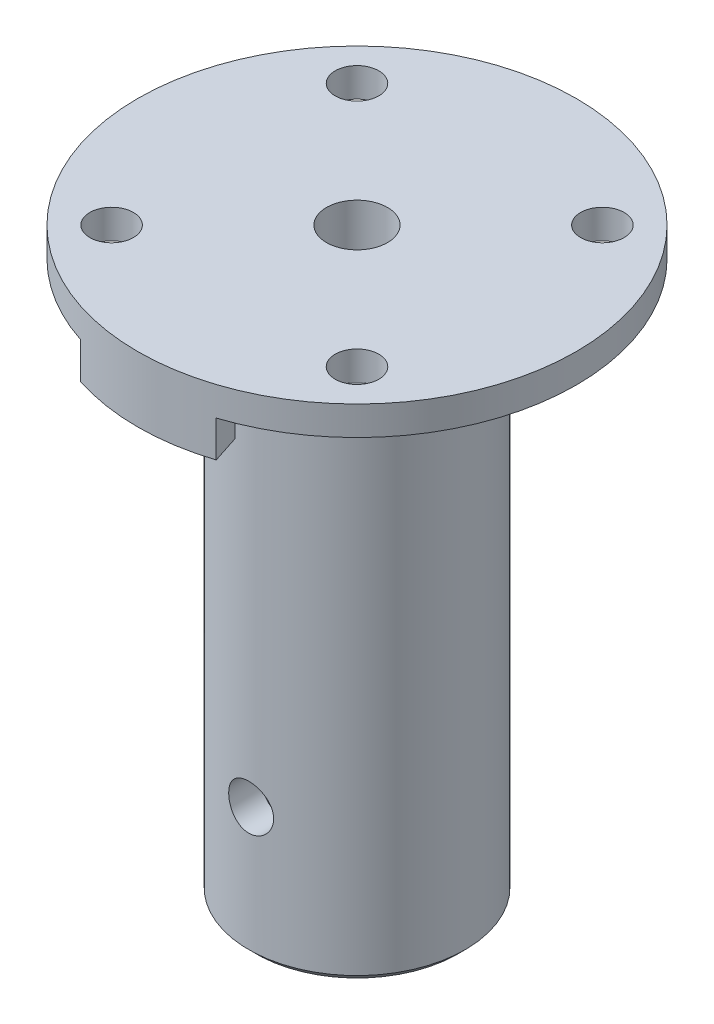
from build123d import *

# Parameters (mm, degrees)
CUT_EXTRUDE_1_DEPTH      = 29.955396734
CUT_EXTRUDE_1_DEPTH_BACK = 29.955396734
SKETCH_2_R               = 1.55
CHAMFER_1_SIZE           = 0.5
SKETCH_4_R               = 5.3
SKETCH_4_R_2             = 2.1
EXTRUDE_1_DEPTH          = 3
SKETCH_5_R               = 1.5
CUT_EXTRUDE_2_DEPTH      = 19
CUT_EXTRUDE_3_DEPTH      = 38


with BuildPart() as part:
    # 草图1 → 旋转1 (revolve)
    with BuildSketch(Plane.XY, mode=Mode.PRIVATE) as revolve_1_sk:
        Polygon((5.3, -24.9), (5.3, 15.1), (10.45, 15.1), (10.45, 10.1), (7.45, 10.1), (7.45, -24.9), align=None)
    revolve(revolve_1_sk.sketch.rotate(Axis((0, 0, 0), (0, 1, 0)), 90), axis=Axis((0, 0, 0), (0, 1, 0)))

    # 草图2 → 切除-拉伸1 (cut, two sides: drawn at the far end of the back side and taken through both)
    with BuildSketch(Plane.XY.offset(-CUT_EXTRUDE_1_DEPTH_BACK)):
        with Locations((0, -15.9)):
            Circle(SKETCH_2_R)
    extrude(amount=CUT_EXTRUDE_1_DEPTH + CUT_EXTRUDE_1_DEPTH_BACK, mode=Mode.SUBTRACT)

    # 倒角1
    chamfer_1_edges = [part.edges().sort_by_distance(p)[0] for p in [
        (0, -24.9, 7.45),
    ]]
    chamfer(chamfer_1_edges, length=CHAMFER_1_SIZE)

    # 草图3 → 旋转2 (revolve)
    with BuildSketch(Plane(origin=(0, 0, 0), x_dir=(0, 0, -1), z_dir=(1, 0, 0)), mode=Mode.PRIVATE) as revolve_2_sk:
        Polygon((10.45, 15.1), (15.1, 15.1), (15.1, 10.6), (13.1, 10.6), (13.1, 13.1), (10.409558261, 13.1), (10.409558261, 15.1), align=None)
    revolve(revolve_2_sk.sketch.rotate(Axis((0, 0, 0), (0, -1, 0)), 180), axis=Axis((0, 0, 0), (0, -1, 0)))

    # 草图4 → 凸台-拉伸1 (add)
    with BuildSketch(Plane(origin=(0, 15.1, 0), x_dir=(1, 0, 0), z_dir=(0, 1, 0))):
        with Locations(Location((0, 0, 0), (0, 0, 90))):
            Circle(SKETCH_4_R)
        with Locations(Location((0, 0, 0), (0, 0, 270))):
            Circle(SKETCH_4_R_2, mode=Mode.SUBTRACT)
    extrude(amount=-EXTRUDE_1_DEPTH)

    # 草图5 → 切除-拉伸2 (cut)
    with BuildSketch(Plane.XZ.offset(-10.1)):
        with Locations(Location((-8.449926035, 8.449926035, 0), (0, 0, 315))):
            Circle(SKETCH_5_R)
        with Locations(Location((8.449926035, 8.449926035, 0), (0, 0, 225))):
            Circle(SKETCH_5_R)
        with Locations(Location((8.449926035, -8.449926035, 0), (0, 0, 272.799179687))):
            Circle(SKETCH_5_R)
        with Locations(Location((-8.449926035, -8.449926035, 0), (0, 0, 267.200820313))):
            Circle(SKETCH_5_R)
    extrude(amount=-CUT_EXTRUDE_2_DEPTH, mode=Mode.SUBTRACT)

    # 草图7 → 切除-拉伸3 (cut)
    with BuildSketch(Plane.XZ.offset(24.9)):
        with BuildLine():
            Line((-3.229227591, 9.938540595), (-5.325886772, 16.39139404))
            ThreePointArc((-5.325886772, 16.39139404), (0, -17.234931636), (5.325886772, 16.39139404))
            Line((5.325886772, 16.39139404), (3.229227591, 9.938540595))
            ThreePointArc((3.229227591, 9.938540595), (0, -10.45), (-3.229227591, 9.938540595))
        make_face()
    extrude(amount=-CUT_EXTRUDE_3_DEPTH, mode=Mode.SUBTRACT)


solid = part.part
